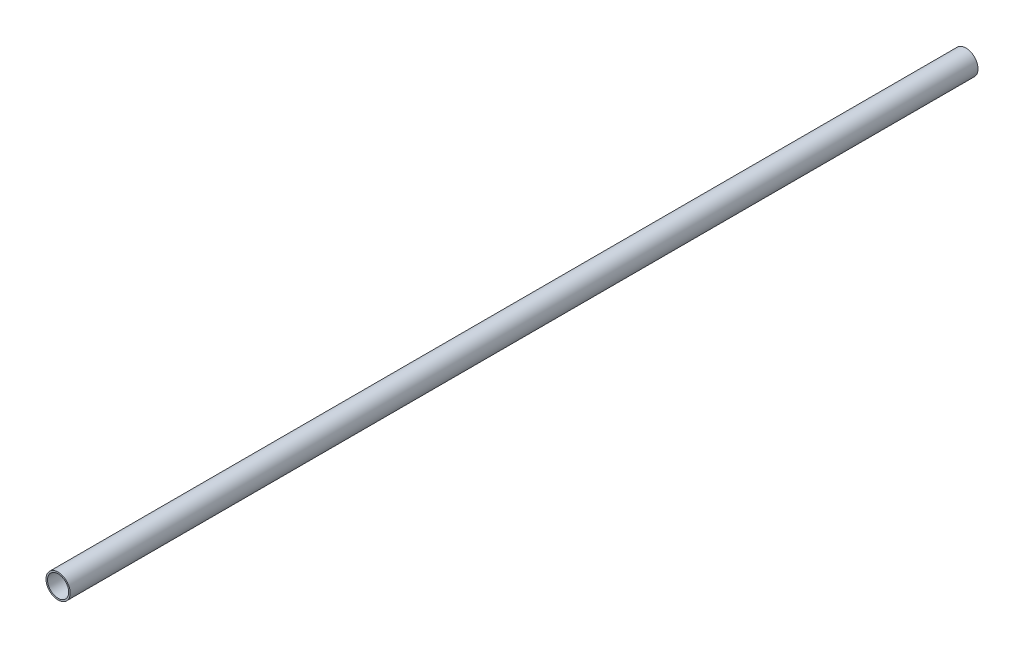
from build123d import *

# Parameters (mm, degrees)
SKETCH1_R           = 8
SKETCH1_R_2         = 7
BOSS_EXTRUDE1_DEPTH = 600


with BuildPart() as part:
    # Sketch1 → Boss-Extrude1 (new body)
    with BuildSketch(Plane.XY):
        Circle(SKETCH1_R)
        Circle(SKETCH1_R_2, mode=Mode.SUBTRACT)
    extrude(amount=BOSS_EXTRUDE1_DEPTH)


solid = part.part
